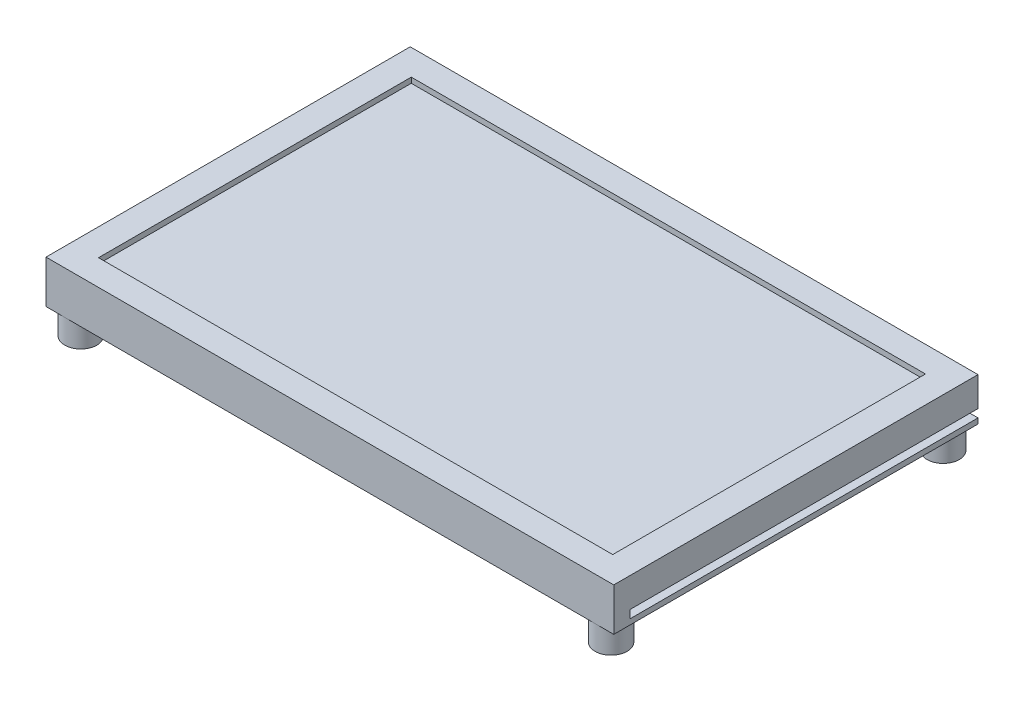
from build123d import *

# Parameters (mm, degrees)
ESQUISSE1_W             = 106
ESQUISSE1_H             = 68
BOSS_EXTRU_1_DEPTH      = 8
ESQUISSE2_R             = 3
BOSS_EXTRU_2_DEPTH      = 4.5
ESQUISSE3_R             = 1.25
ENL_V_MAT_EXTRU_1_DEPTH = 7
ESQUISSE4_W             = 106
ESQUISSE4_H             = 1.5
ENL_V_MAT_EXTRU_3_DEPTH = 65
ESQUISSE10_W            = 96
ESQUISSE10_H            = 58.390488624
ENL_V_MAT_EXTRU_5_DEPTH = 1


with BuildPart() as part:
    # Esquisse1 → Boss.-Extru.1 (new body)
    with BuildSketch(Plane(origin=(0, 0, 0), x_dir=(1, 0, 0), z_dir=(0, 1, 0))):
        Rectangle(ESQUISSE1_W, ESQUISSE1_H)
    extrude(amount=BOSS_EXTRU_1_DEPTH)

    # Esquisse2 → Boss.-Extru.2 (add)
    with BuildSketch(Plane.XZ):
        with Locations(Location((-49.5, 31, 0), (0, 0, 90))):
            Circle(ESQUISSE2_R)
        with Locations(Location((-49.5, -31, 0), (0, 0, 90))):
            Circle(ESQUISSE2_R)
        with Locations(Location((49.5, -31, 0), (0, 0, 270))):
            Circle(ESQUISSE2_R)
        with Locations(Location((49.5, 31, 0), (0, 0, 90))):
            Circle(ESQUISSE2_R)
        with Locations(Location((-30.5, 24.5, 0), (0, 0, 90))):
            Circle(ESQUISSE2_R)
        with Locations(Location((27.5, 24.5, 0), (0, 0, 90))):
            Circle(ESQUISSE2_R)
        with Locations(Location((27.5, -24.5, 0), (0, 0, 90))):
            Circle(ESQUISSE2_R)
        with Locations(Location((-30.5, -24.5, 0), (0, 0, 90))):
            Circle(ESQUISSE2_R)
    extrude(amount=BOSS_EXTRU_2_DEPTH)

    # Esquisse3 → Enlèv. mat.-Extru.1 (cut)
    with BuildSketch(Plane.XZ.offset(4.5)):
        with Locations(Location((-49.5, 31, 0), (0, 0, 270))):
            Circle(ESQUISSE3_R)
        with Locations(Location((49.5, 31, 0), (0, 0, 90))):
            Circle(ESQUISSE3_R)
        with Locations(Location((49.5, -31, 0), (0, 0, 270))):
            Circle(ESQUISSE3_R)
        with Locations(Location((-49.5, -31, 0), (0, 0, 90))):
            Circle(ESQUISSE3_R)
        with Locations(Location((-30.5, 24.5, 0), (0, 0, 270))):
            Circle(ESQUISSE3_R)
        with Locations(Location((27.5, 24.5, 0), (0, 0, 90))):
            Circle(ESQUISSE3_R)
        with Locations(Location((27.5, -24.5, 0), (0, 0, 270))):
            Circle(ESQUISSE3_R)
        with Locations(Location((-30.5, -24.5, 0), (0, 0, 90))):
            Circle(ESQUISSE3_R)
    extrude(amount=-ENL_V_MAT_EXTRU_1_DEPTH, mode=Mode.SUBTRACT)

    # Esquisse4 → Enlèv. mat.-Extru.3 (cut)
    with BuildSketch(Plane(origin=(0, 0, -34), x_dir=(-1, 0, 0), z_dir=(0, 0, -1))):
        with Locations((0, 1.75)):
            Rectangle(ESQUISSE4_W, ESQUISSE4_H)
    extrude(amount=-ENL_V_MAT_EXTRU_3_DEPTH, mode=Mode.SUBTRACT)

    # Esquisse10 → Enlèv. mat.-Extru.5 (cut)
    with BuildSketch(Plane(origin=(0, 8, 0), x_dir=(1, 0, 0), z_dir=(0, 1, 0))):
        Rectangle(ESQUISSE10_W, ESQUISSE10_H)
    extrude(amount=-ENL_V_MAT_EXTRU_5_DEPTH, mode=Mode.SUBTRACT)


solid = part.part
